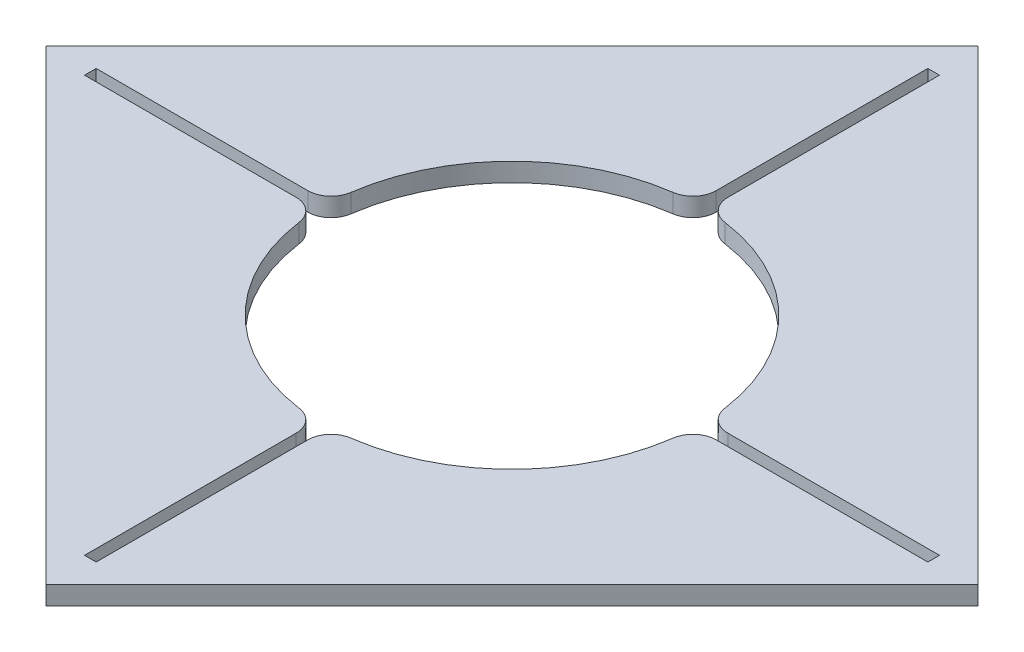
from build123d import *

# Parameters (mm, degrees)
BOSS_EXTRUDE1_DEPTH = 5.08


with BuildPart() as part:
    # Sketch1 → Boss-Extrude1 (new body)
    with BuildSketch(Plane(origin=(0, 0, 0), x_dir=(1, 0, 0), z_dir=(0, 1, 0))):
        Polygon((-127, 0), (0, -127), (127, 0), (0, 127), align=None)
        with BuildLine():
            Line((114.910495706, 1.5875), (114.910495706, -1.5875))
            Line((114.910495706, -1.5875), (57.237245905, -1.5875))
            ThreePointArc((57.237245905, -1.5875), (53.066892499, -3.148903914), (50.947438662, -7.065247253))
            ThreePointArc((50.947438662, -7.065247253), (36.37003729, -36.37003729), (7.065247253, -50.947438662))
            ThreePointArc((7.065247253, -50.947438662), (3.148903914, -53.066892499), (1.5875, -57.237245905))
            Line((1.5875, -57.237245905), (1.5875, -114.910495706))
            Line((1.5875, -114.910495706), (-1.5875, -114.910495706))
            Line((-1.5875, -114.910495706), (-1.5875, -57.237245905))
            ThreePointArc((-1.5875, -57.237245905), (-3.148903914, -53.066892499), (-7.065247253, -50.947438662))
            ThreePointArc((-7.065247253, -50.947438662), (-36.37003729, -36.37003729), (-50.947438662, -7.065247253))
            ThreePointArc((-50.947438662, -7.065247253), (-53.066892499, -3.148903914), (-57.237245905, -1.5875))
            Line((-57.237245905, -1.5875), (-114.910495706, -1.5875))
            Line((-114.910495706, -1.5875), (-114.910495706, 1.5875))
            Line((-114.910495706, 1.5875), (-57.237245905, 1.5875))
            ThreePointArc((-57.237245905, 1.5875), (-53.066892499, 3.148903914), (-50.947438662, 7.065247253))
            ThreePointArc((-50.947438662, 7.065247253), (-36.37003729, 36.37003729), (-7.065247253, 50.947438662))
            ThreePointArc((-7.065247253, 50.947438662), (-3.148903914, 53.066892499), (-1.5875, 57.237245905))
            Line((-1.5875, 57.237245905), (-1.5875, 114.910495706))
            Line((-1.5875, 114.910495706), (1.5875, 114.910495706))
            Line((1.5875, 114.910495706), (1.5875, 57.237245905))
            ThreePointArc((1.5875, 57.237245905), (3.148903914, 53.066892499), (7.065247253, 50.947438662))
            ThreePointArc((7.065247253, 50.947438662), (36.37003729, 36.37003729), (50.947438662, 7.065247253))
            ThreePointArc((50.947438662, 7.065247253), (53.066892499, 3.148903914), (57.237245905, 1.5875))
            Line((57.237245905, 1.5875), (114.910495706, 1.5875))
        make_face(mode=Mode.SUBTRACT)
    extrude(amount=BOSS_EXTRUDE1_DEPTH)


solid = part.part
